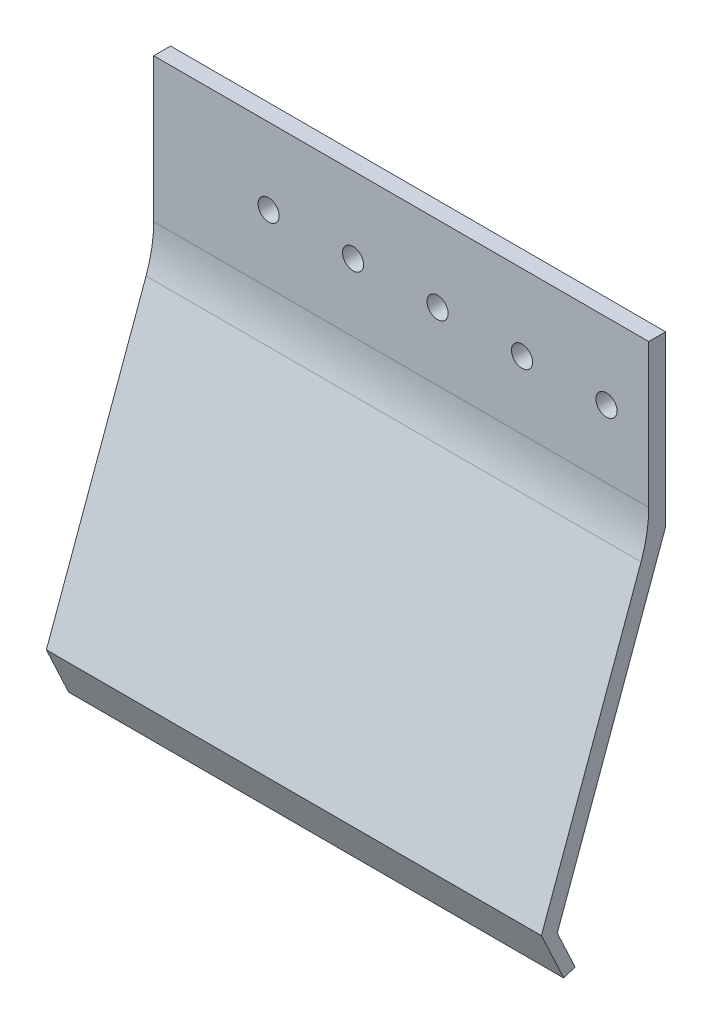
from build123d import *

# Parameters (mm, degrees)
SKETCH1_W           = 109.4
SKETCH1_H           = 109.4
SKETCH1_W_2         = 79.4
SKETCH1_H_2         = 79.4
SKETCH1_R           = 6
SKETCH1_R_2         = 1.5
BOSS_EXTRUDE1_DEPTH = 8
BOSS_EXTRUDE2_DEPTH = 109.4
FILLET1_R           = 30
SKETCH5_W           = 8
SKETCH5_H           = 149.4
BOSS_EXTRUDE3_DEPTH = 109.4
SKETCH3_W           = 8
SKETCH3_H           = 109.4
CUT_EXTRUDE4_DEPTH  = 135
SKETCH7_W           = 8
SKETCH7_H           = 40
CUT_EXTRUDE5_DEPTH  = 135
SKETCH4_R           = 2.5
CUT_EXTRUDE6_DEPTH  = 10
BOSS_EXTRUDE4_START = 7.8
BOSS_EXTRUDE4_DEPTH = 7.8


with BuildPart() as part:
    # Sketch1 → Boss-Extrude1 (new body)
    # profile 1 of 2: a face of its own
    with BuildSketch(Plane.XY):
        with Locations((-17.5, 17.5)):
            Rectangle(SKETCH1_W, SKETCH1_H)
        with Locations((-17.5, 17.5)):
            Rectangle(SKETCH1_W_2, SKETCH1_H_2, mode=Mode.SUBTRACT)
    # profile 2 of 2: a face of its own
    with BuildSketch(Plane.XY):
        with Locations((-17.5, 17.5)):
            Rectangle(SKETCH1_W_2, SKETCH1_H_2)
        with Locations((-35, 0)):
            Circle(SKETCH1_R, mode=Mode.SUBTRACT)
        Circle(SKETCH1_R, mode=Mode.SUBTRACT)
        with Locations((0, 35)):
            Circle(SKETCH1_R, mode=Mode.SUBTRACT)
        with Locations((-35, 35)):
            Circle(SKETCH1_R, mode=Mode.SUBTRACT)
        with Locations((-52.809903828, -17.809903828)):
            Circle(SKETCH1_R_2, mode=Mode.SUBTRACT)
        with Locations((-17.5, -17.5)):
            Circle(SKETCH1_R_2, mode=Mode.SUBTRACT)
        with Locations((17.5, -17.5)):
            Circle(SKETCH1_R_2, mode=Mode.SUBTRACT)
        with Locations((17.5, 17.5)):
            Circle(SKETCH1_R_2, mode=Mode.SUBTRACT)
        with Locations((-17.5, 17.5)):
            Circle(SKETCH1_R_2, mode=Mode.SUBTRACT)
        with Locations((-52.5, 17.5)):
            Circle(SKETCH1_R_2, mode=Mode.SUBTRACT)
        with Locations((17.5, 52.5)):
            Circle(SKETCH1_R_2, mode=Mode.SUBTRACT)
        with Locations((-17.5, 52.5)):
            Circle(SKETCH1_R_2, mode=Mode.SUBTRACT)
        with Locations((-52.5, 52.5)):
            Circle(SKETCH1_R_2, mode=Mode.SUBTRACT)
    extrude(amount=BOSS_EXTRUDE1_DEPTH)



with BuildPart() as body_2:
    # Sketch2 → Boss-Extrude2 (new body)
    with BuildSketch(Plane(origin=(37.2, 0, 0), x_dir=(0, 0, -1), z_dir=(1, 0, 0))):
        Polygon((-8, 72.2), (-33.651510749, 1.723053441), (-29.425328132, -7.340024429), (-32.127552961, -8.237713324), (-37.410281233, 3.091134014), (-12, 72.905307923), (-12, 112.2), (-8, 112.2), align=None)
    extrude(amount=-BOSS_EXTRUDE2_DEPTH)

    # Fillet1
    fillet1_edges = [body_2.edges().sort_by_distance(p)[0] for p in [
        (-17.5, 72.905307923, 12),
    ]]
    fillet(fillet1_edges, radius=FILLET1_R)


with BuildPart() as part_1:
    add(part.part)

    add(body_2.part)  # Boss-Extrude3 merges body 2
    # Sketch5 → Boss-Extrude3 (add)
    with BuildSketch(Plane(origin=(37.2, 0, 0), x_dir=(0, 0, -1), z_dir=(1, 0, 0))):
        with Locations((-4, 37.5)):
            Rectangle(SKETCH5_W, SKETCH5_H)
    extrude(amount=-BOSS_EXTRUDE3_DEPTH)

    # Sketch3 → Cut-Extrude4 (cut)
    with BuildSketch(Plane(origin=(37.2, 0, 0), x_dir=(0, 0, -1), z_dir=(1, 0, 0))):
        with Locations((-4, 17.5)):
            Rectangle(SKETCH3_W, SKETCH3_H)
    extrude(amount=-CUT_EXTRUDE4_DEPTH, mode=Mode.SUBTRACT)

    # Sketch7 → Cut-Extrude5 (cut)
    with BuildSketch(Plane(origin=(37.2, 0, 0), x_dir=(0, 0, -1), z_dir=(1, 0, 0))):
        with Locations((-4, 92.2)):
            Rectangle(SKETCH7_W, SKETCH7_H)
    extrude(amount=-CUT_EXTRUDE5_DEPTH, mode=Mode.SUBTRACT)

    # Sketch4 → Cut-Extrude6 (cut)
    with BuildSketch(Plane.XY.offset(12)):
        with Locations((-52.8, 94.2)):
            Circle(SKETCH4_R)
        with Locations((-32.8, 94.2)):
            Circle(SKETCH4_R)
        with Locations((-12.8, 94.2)):
            Circle(SKETCH4_R)
        with Locations((7.2, 94.2)):
            Circle(SKETCH4_R)
        with Locations((27.2, 94.2)):
            Circle(SKETCH4_R)
    extrude(amount=-CUT_EXTRUDE6_DEPTH, mode=Mode.SUBTRACT)

    # Sketch8 → Boss-Extrude4 (add)
    with BuildSketch(Plane.ZY.offset(72.2).offset(BOSS_EXTRUDE4_START)):
        with BuildLine():
            Line((12, 112.2), (8, 112.2))
            Line((8, 112.2), (8, 72.2))
            Line((8, 72.2), (33.651510749, 1.723053441))
            Line((33.651510749, 1.723053441), (29.425328132, -7.340024429))
            Line((29.425328132, -7.340024429), (32.127552961, -8.237713324))
            Line((32.127552961, -8.237713324), (37.410281233, 3.091134014))
            Line((37.410281233, 3.091134014), (13.809221376, 67.934513044))
            ThreePointArc((13.809221376, 67.934513044), (12.45576741, 72.985672014), (12, 78.195117344))
            Line((12, 78.195117344), (12, 112.2))
        make_face()
    extrude(amount=-BOSS_EXTRUDE4_DEPTH)


solid = part_1.part
